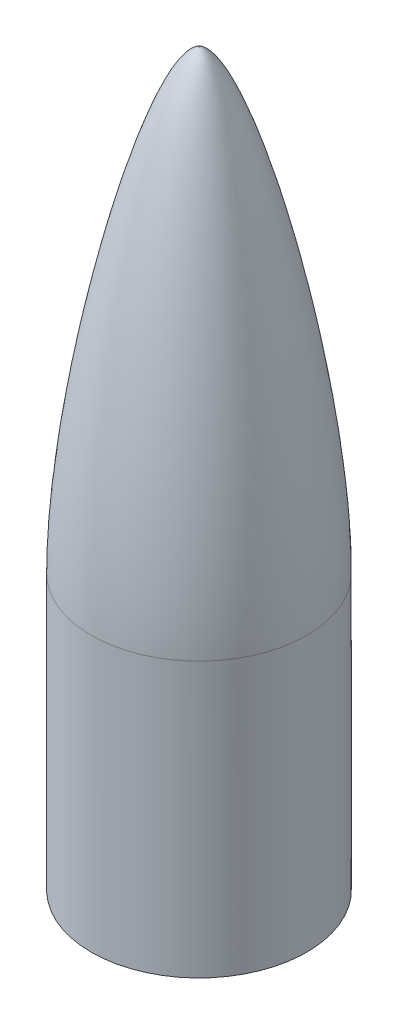
from build123d import *


with BuildPart() as part:
    # Sketch2 → Revolve1 (revolve)
    with BuildSketch(Plane.XY, mode=Mode.PRIVATE) as revolve1_sk:
        with BuildLine():
            Line((2.85, 0), (2.85, 7.257137991))
            add(Edge.make_bspline(
                [(0, 19.3), (1.017950029, 19.122863414), (2.85, 11.515503532), (2.85, 7.257137991)],
                knots=[0, 0, 0, 0, 1, 1, 1, 1], degree=3))
            Line((0, 19.3), (0, 0))
            Line((0, 0), (2.85, 0))
        make_face()
    revolve(revolve1_sk.sketch.rotate(Axis((0, 0, 0), (0, 1, 0)), 90), axis=Axis((0, 0, 0), (0, 1, 0)))


solid = part.part
